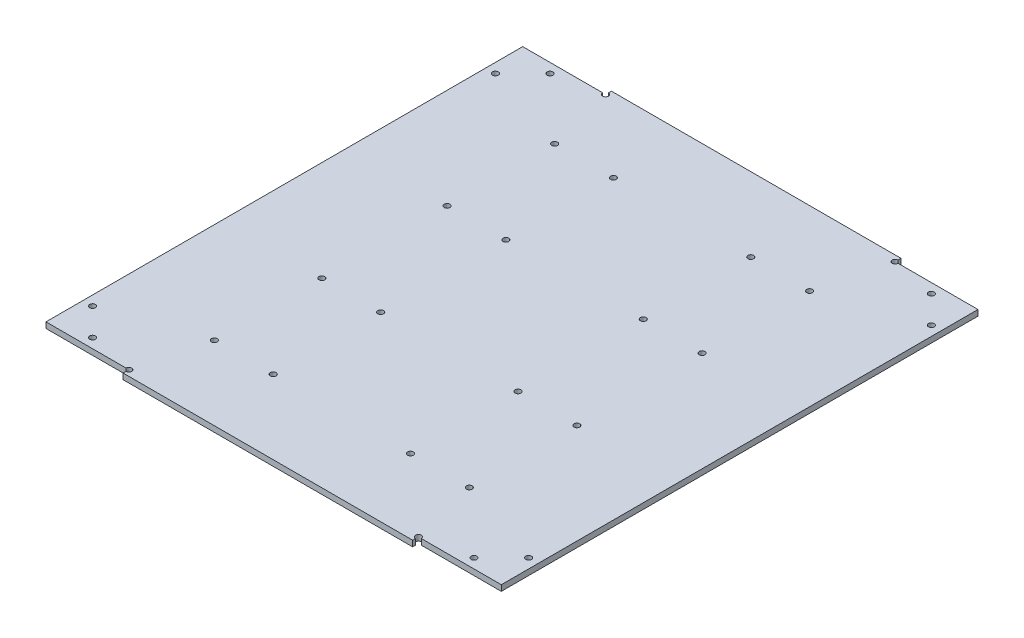
from build123d import *

# Parameters (mm, degrees)
RESSALTO_EXTRUS_O2_DEPTH = 6
RESSALTO_EXTRUS_O3_DEPTH = 6
CORTE_EXTRUS_O2_DEPTH    = 10
ESBO_O7_W                = 235.908254568
ESBO_O7_H                = 6
RESSALTO_EXTRUS_O4_DEPTH = 253
ESBO_O8_W                = 6.266008042
ESBO_O8_H                = 6
CORTE_EXTRUS_O3_DEPTH    = 6
ESBO_O9_R                = 3
CORTE_EXTRUS_O4_DEPTH    = 342.610457354
ESBO_O10_R               = 3
CORTE_EXTRUS_O5_DEPTH    = 553.891223092


with BuildPart() as part:
    # Esboço1 → Ressalto-extrusão2 (new body)
    with BuildSketch(Plane.XY):
        with BuildLine():
            Line((-199.999999999, 0), (199.999999999, 0))
            ThreePointArc((199.999999999, 0), (202.565835097, -15.811388301), (209.999999999, -30))
            Line((209.999999999, -30), (289.999999999, -30))
            ThreePointArc((289.999999999, -30), (299.999014124, 0.31398499), (289.62007067, 30.5))
            ThreePointArc((289.62007067, 30.5), (297.818976076, 75.60635228), (265.815415017, 108.432822474))
            Line((265.815415017, 108.432822474), (246.403986634, 35.988385502))
            ThreePointArc((246.403986634, 35.988385502), (242.72975202, 33.867065158), (240.608431676, 37.541299773))
            Line((240.608431676, 37.541299773), (260.019860059, 109.985736744))
            ThreePointArc((260.019860059, 109.985736744), (218.38507475, 99.736242739), (199.999999999, 61))
            Line((199.999999999, 61), (140, 61))
            Line((140, 61), (150.784643454, 58.387579086))
            Line((150.784643454, 58.387579086), (139.047219324, 52.742194858))
            Line((139.047219324, 52.742194858), (160.085396074, 40.245061921))
            Line((160.085396074, 40.245061921), (137.597498913, 43.437533109))
            Line((137.597498913, 43.437533109), (153.154101004, 34.194272541))
            Line((153.154101004, 34.194272541), (138.26257587, 30.30469508))
            Line((138.26257587, 30.30469508), (144.152507453, 26))
            Line((144.152507453, 26), (149.999999999, 26))
            ThreePointArc((149.999999999, 26), (152.999999999, 23), (149.999999999, 20))
            Line((149.999999999, 20), (-149.999999999, 20))
            ThreePointArc((-149.999999999, 20), (-152.999999999, 23), (-149.999999999, 26))
            Line((-149.999999999, 26), (-144.152507453, 26))
            Line((-144.152507453, 26), (-138.26257587, 30.30469508))
            Line((-138.26257587, 30.30469508), (-153.154101004, 34.194272541))
            Line((-153.154101004, 34.194272541), (-137.597498913, 43.437533109))
            Line((-137.597498913, 43.437533109), (-160.085396074, 40.245061921))
            Line((-160.085396074, 40.245061921), (-139.047219324, 52.742194858))
            Line((-139.047219324, 52.742194858), (-150.784643454, 58.387579086))
            Line((-150.784643454, 58.387579086), (-140, 61))
            Line((-140, 61), (-199.999999999, 61))
            ThreePointArc((-199.999999999, 61), (-218.38507475, 99.736242739), (-260.019860059, 109.985736744))
            Line((-260.019860059, 109.985736744), (-240.608431676, 37.541299773))
            ThreePointArc((-240.608431676, 37.541299773), (-242.72975202, 33.867065158), (-246.403986634, 35.988385502))
            Line((-246.403986634, 35.988385502), (-265.815415017, 108.432822474))
            ThreePointArc((-265.815415017, 108.432822474), (-297.818976076, 75.60635228), (-289.62007067, 30.5))
            ThreePointArc((-289.62007067, 30.5), (-299.999014124, 0.31398499), (-289.999999999, -30))
            Line((-289.999999999, -30), (-209.999999999, -30))
            ThreePointArc((-209.999999999, -30), (-202.565835097, -15.811388301), (-199.999999999, 0))
        make_face()
    extrude(amount=RESSALTO_EXTRUS_O2_DEPTH)

    # Esboço5 → Corte-extrusão2 (cut)
    with BuildSketch(Plane.XY.offset(6)):
        Polygon((-341.805819903, 0), (-379.563439543, 0), (-379.563439543, 200.23140607), (0, 200.23140607), (0, 0), (-124.202696186, 0), (-124.202696186, -126.67009029), (-341.805819903, -126.67009029), align=None)
    extrude(amount=-CORTE_EXTRUS_O2_DEPTH, mode=Mode.SUBTRACT)


with BuildPart() as body_2:
    # Esboço4 → Ressalto-extrusão3 (new body)
    with BuildSketch(Plane(origin=(215.105397993, -57.63731768, 0), x_dir=(0, 0, -1), z_dir=(0.9659258262890679, -0.25881904510252246, 0))):
        with BuildLine():
            Line((246.999999999, 62.536155533), (246.999999999, 123.536155533))
            Line((246.999999999, 123.536155533), (47, 123.536155533))
            ThreePointArc((47, 123.536155533), (32.355339059, 158.891494592), (-3, 173.536155533))
            ThreePointArc((-3, 173.536155533), (-47.860896112, 145.615557699), (-42.620070671, 93.036155533))
            ThreePointArc((-42.620070671, 93.036155533), (-52.987511897, 61.418723482), (-41.217566642, 30.296155533))
            Line((-41.217566642, 30.296155533), (35.217566642, 30.296155533))
            ThreePointArc((35.217566642, 30.296155533), (43.96210351, 45.373380875), (47, 62.536155533))
            Line((47, 62.536155533), (246.999999999, 62.536155533))
        make_face()
    extrude(amount=RESSALTO_EXTRUS_O3_DEPTH)


with BuildPart() as body_3:
    # Esboço7 → Ressalto-extrusão4 (new body)
    with BuildSketch(Plane.XY.offset(6)):
        with Locations((117.954127284, 23)):
            Rectangle(ESBO_O7_W, ESBO_O7_H)
    extrude(amount=-RESSALTO_EXTRUS_O4_DEPTH)

    # Combinar1: cut part, body 2
    add(part.part, mode=Mode.SUBTRACT)
    add(body_2.part, mode=Mode.SUBTRACT)

    # Esboço8 → Corte-extrusão3 (cut)
    with BuildSketch(Plane.XY.offset(6)):
        with Locations((153.13300402, 23)):
            Rectangle(ESBO_O8_W, ESBO_O8_H)
    extrude(amount=-CORTE_EXTRUS_O3_DEPTH, mode=Mode.SUBTRACT)

    # Esboço9 → Corte-extrusão4 (cut, through all)
    with BuildSketch(Plane(origin=(0, 26, 0), x_dir=(1, 0, 0), z_dir=(0, 1, 0))):
        with Locations(Location((225.908254568, 38.284271247, 0), (0, 0, 270))):
            Circle(ESBO_O9_R)
        with Locations(Location((197.623983321, 10, 0), (0, 0, 270))):
            Circle(ESBO_O9_R)
        with Locations(Location((71.161943972, 70.690502615, 0), (0, 0, 270))):
            Circle(ESBO_O9_R)
        with Locations(Location((132.122360106, 70.690502615, 0), (0, 0, 270))):
            Circle(ESBO_O9_R)
        with Locations(Location((71.161943972, 182.100918308, 0), (0, 0, 270))):
            Circle(ESBO_O9_R)
        with Locations(Location((132.122360106, 182.100918308, 0), (0, 0, 270))):
            Circle(ESBO_O9_R)
    extrude(amount=-CORTE_EXTRUS_O4_DEPTH, mode=Mode.SUBTRACT)

    # Espelhar1: body 3 across plane


with BuildPart() as body_3_1:
    add(body_3.part)
    add(body_3.part.mirror(Plane(origin=(0, 26, -246.999999999), x_dir=(0, 0, 1), z_dir=(-1, 0, 0))))

    # Espelhar3: body 3 across plane


with BuildPart() as body_3_2:
    add(body_3_1.part)
    add(body_3_1.part.mirror(Plane.XY.offset(-246.999999999)))

    # Esboço10 → Corte-extrusão5 (cut, through all)
    with BuildSketch(Plane(origin=(0, 20, 0), x_dir=(-1, 0, 0), z_dir=(0, -1, 0))):
        with Locations((149.999999999, 0)):
            Circle(ESBO_O10_R)
        with Locations((-149.999999999, 0)):
            Circle(ESBO_O10_R)
        with Locations((-149.999999999, 493.999999998)):
            Circle(ESBO_O10_R)
        with Locations((149.999999999, 493.999999998)):
            Circle(ESBO_O10_R)
    extrude(amount=-CORTE_EXTRUS_O5_DEPTH, mode=Mode.SUBTRACT)


solid = body_3_2.part
